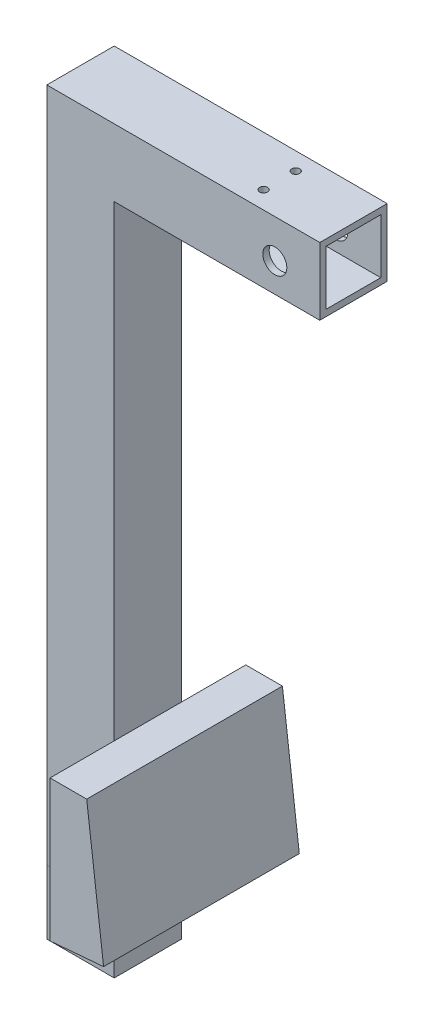
from build123d import *

# Parameters (mm, degrees)
SKETCH3_W                = 26.67
SKETCH3_H                = 26.67
SKETCH3_W_2              = 21.59
SKETCH3_H_2              = 21.59
BOSS_EXTRUDE1_DEPTH      = 25.4
BOSS_EXTRUDE1_DEPTH_BACK = 52.07
SKETCH8_W                = 26.67
SKETCH8_H                = 26.67
SKETCH8_W_2              = 21.59
SKETCH8_H_2              = 21.59
BOSS_EXTRUDE2_DEPTH      = 25.4
SKETCH9_R                = 4.7625
CUT_EXTRUDE1_DEPTH       = 637.557260443
SKETCH10_R               = 1.5875
CUT_EXTRUDE2_DEPTH       = 681.663834945


with BuildPart() as part:
    # Sweep1: sweep along a path in Sketch1
    with BuildLine(Plane.XY) as sweep1_path:
        Line((-598.06984839, -137.16), (-598.06984839, 115.070893757))
        Line((-598.06984839, 115.070893757), (-505.204841138, 115.070893757))
    # Sketch3 → Sweep1 (sweep)
    with BuildSketch(Plane(origin=(0, -137.16, 0), x_dir=(-1, 0, 0), z_dir=(0, 1, 0))):
        with Locations((599.908921554, 0)):
            Rectangle(SKETCH3_W, SKETCH3_H)
        with Locations((599.908921554, 0)):
            Rectangle(SKETCH3_W_2, SKETCH3_H_2, mode=Mode.SUBTRACT)
    sweep(path=sweep1_path.line, transition=Transition.RIGHT)

    # Sketch7 → Boss-Extrude1 (add, two sides: drawn at the far end of the back side and taken through both)
    with BuildSketch(Plane(origin=(0, 0, -13.335), x_dir=(-1, 0, 0), z_dir=(0, 0, -1)).offset(-BOSS_EXTRUDE1_DEPTH_BACK)):
        Polygon((586.573921554, -137.16), (565.380149791, -135.369703544), (572.062710026, -81.27839133), (586.573921554, -81.27839133), align=None)
    extrude(amount=BOSS_EXTRUDE1_DEPTH + BOSS_EXTRUDE1_DEPTH_BACK)

    # Sketch9 → Cut-Extrude1 (cut, through all)
    with BuildSketch(Plane(origin=(0, 0, -13.335), x_dir=(-1, 0, 0), z_dir=(0, 0, -1))):
        with Locations((523.010694713, 115.070893757)):
            Circle(SKETCH9_R)
    extrude(amount=-CUT_EXTRUDE1_DEPTH, mode=Mode.SUBTRACT)

    # Sketch10 → Cut-Extrude2 (cut, through all)
    with BuildSketch(Plane(origin=(0, 130.244966921, 0), x_dir=(1, 0, 0), z_dir=(0, 1, 0))):
        with Locations(Location((-534.414841138, 6.35, 0), (0, 0, 270))):
            Circle(SKETCH10_R)
        with Locations(Location((-534.414841138, -6.35, 0), (0, 0, 270))):
            Circle(SKETCH10_R)
    extrude(amount=-CUT_EXTRUDE2_DEPTH, mode=Mode.SUBTRACT)


with BuildPart() as body_2:
    # Sketch8 → Boss-Extrude2 (new body)
    with BuildSketch(Plane.XZ.offset(137.16)):
        with Locations((-599.908921554, 0)):
            Rectangle(SKETCH8_W, SKETCH8_H)
        with Locations((-599.908921554, 0)):
            Rectangle(SKETCH8_W_2, SKETCH8_H_2, mode=Mode.SUBTRACT)
    extrude(amount=BOSS_EXTRUDE2_DEPTH)


solid = Compound([part.part, body_2.part])
